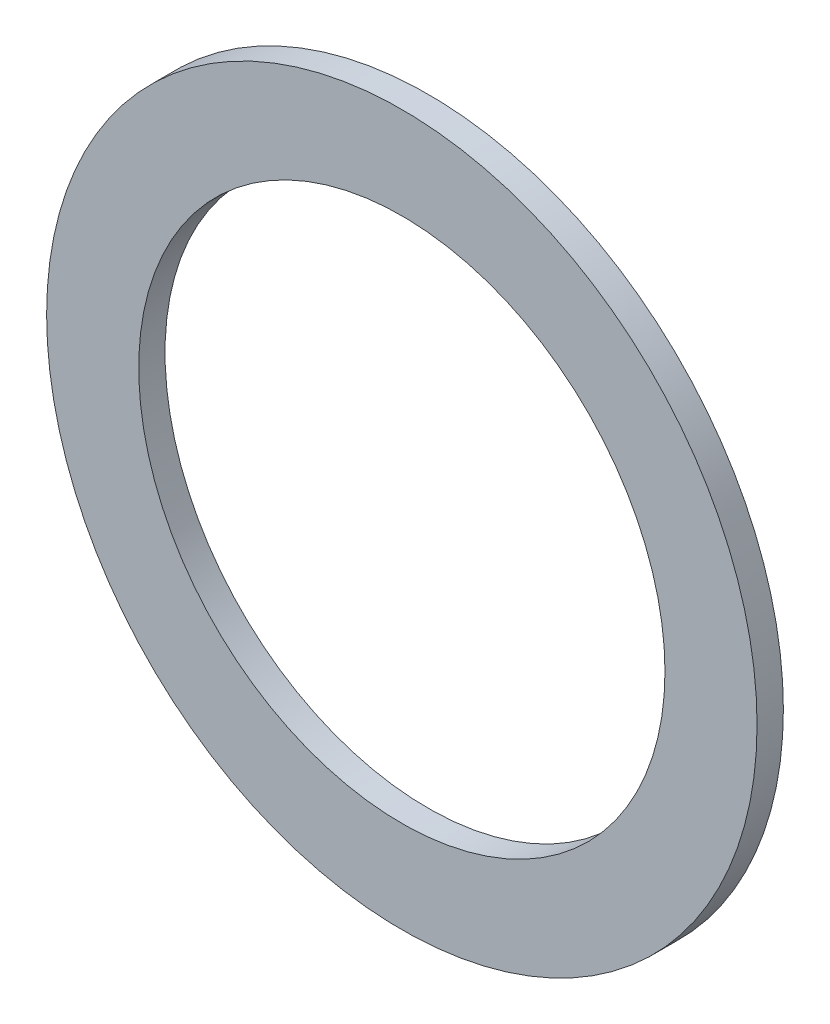
from build123d import *

# Parameters (mm, degrees)
SKETCH1_R           = 13.5
SKETCH1_R_2         = 10
BOSS_EXTRUDE1_DEPTH = 1


with BuildPart() as part:
    # Sketch1 → Boss-Extrude1 (new body)
    with BuildSketch(Plane.XY):
        Circle(SKETCH1_R)
        Circle(SKETCH1_R_2, mode=Mode.SUBTRACT)
    extrude(amount=BOSS_EXTRUDE1_DEPTH)


solid = part.part
